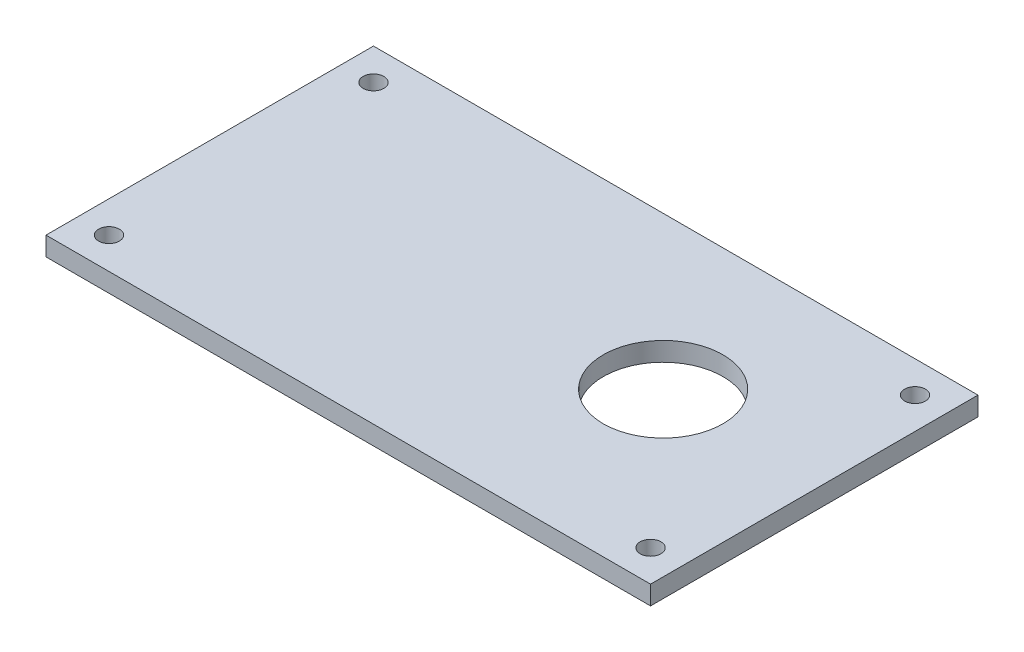
from build123d import *

# Parameters (mm, degrees)
SKETCH1_W           = 96
SKETCH1_H           = 52
BOSS_EXTRUDE1_DEPTH = 3
SKETCH2_R           = 1.65
SKETCH2_R_2         = 9.5
CUT_EXTRUDE1_DEPTH  = 3


with BuildPart() as part:
    # Sketch1 → Boss-Extrude1 (new body)
    with BuildSketch(Plane(origin=(0, 0, 0), x_dir=(1, 0, 0), z_dir=(0, 1, 0))):
        Rectangle(SKETCH1_W, SKETCH1_H)
    extrude(amount=BOSS_EXTRUDE1_DEPTH)

    # Sketch2 → Cut-Extrude1 (cut)
    with BuildSketch(Plane(origin=(0, 3, 0), x_dir=(1, 0, 0), z_dir=(0, 1, 0))):
        with Locations(Location((-43, 21, 0), (0, 0, 270))):
            Circle(SKETCH2_R)
        with Locations(Location((43, 21, 0), (0, 0, 270))):
            Circle(SKETCH2_R)
        with Locations(Location((43, -21, 0), (0, 0, 270))):
            Circle(SKETCH2_R)
        with Locations(Location((-43, -21, 0), (0, 0, 270))):
            Circle(SKETCH2_R)
        with Locations(Location((22.2, 1.8, 0), (0, 0, 270))):
            Circle(SKETCH2_R_2)
    extrude(amount=-CUT_EXTRUDE1_DEPTH, mode=Mode.SUBTRACT)


solid = part.part
